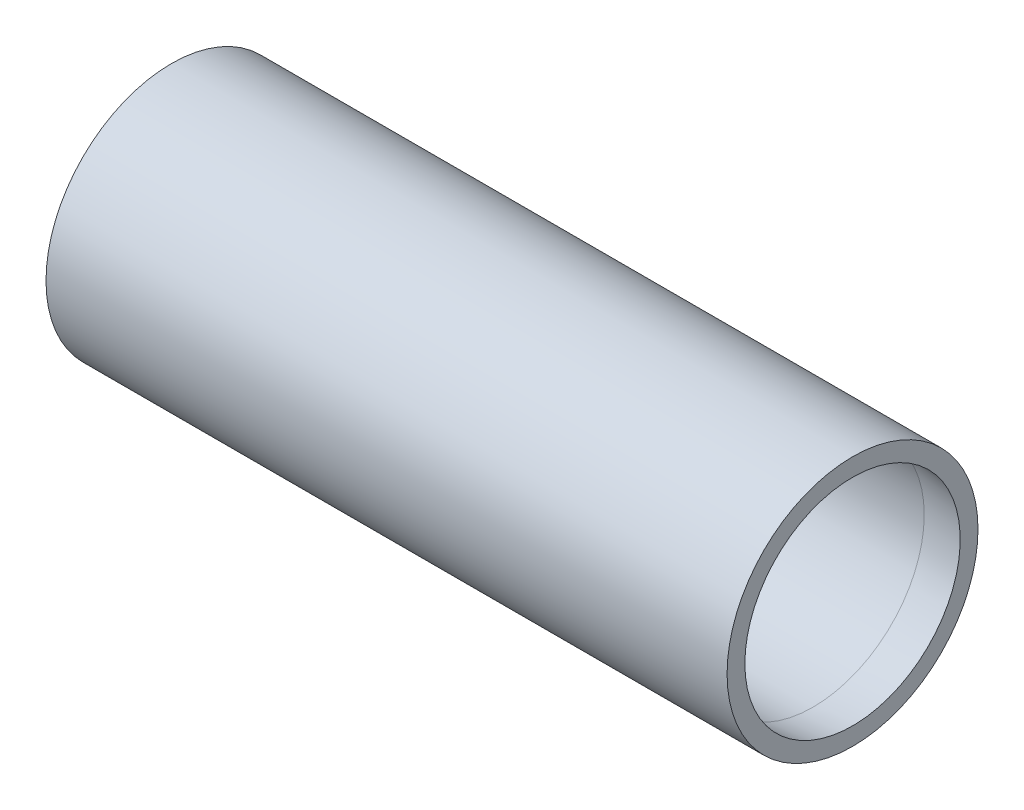
from build123d import *


with BuildPart() as part:
    # Sketch1 → Revolve1 (revolve)
    with BuildSketch(Plane.XY, mode=Mode.PRIVATE) as revolve1_sk:
        Polygon((0, 17.5), (95, 17.5), (95, 15.018812351), (89.5, 15.5), (0, 15.5), align=None)
    revolve(revolve1_sk.sketch.rotate(Axis((0, 0, 0), (1, 0, 0)), 90), axis=Axis((0, 0, 0), (1, 0, 0)))


solid = part.part
